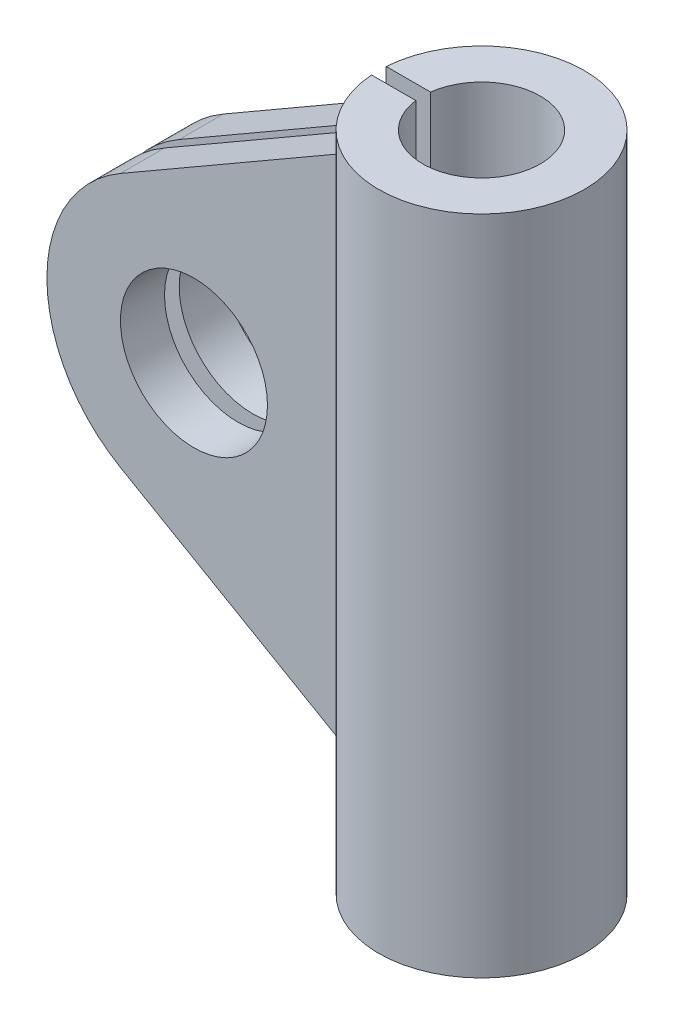
from build123d import *

# Parameters (mm, degrees)
SKETCH_1_R           = 10
EXTRUDE_1_DEPTH      = 7
EXTRUDE_2_DEPTH      = 20
EXTRUDE_2_DEPTH_BACK = 25
SKETCH_2_R           = 7
SKETCH_3_R           = 4
SKETCH_3_W           = 26.062177826
SKETCH_3_H           = 1
CUT_EXTRUDE_1_DEPTH  = 55
SKETCH_4_R           = 5
CUT_EXTRUDE_2_DEPTH  = 55


with BuildPart() as part:
    # Эскиз1 → Бобышка-Вытянуть1 (new body)
    with BuildSketch(Plane.XY):
        Circle(SKETCH_1_R)
        with BuildLine():
            Line((10, -17.320508076), (10, 0))
            ThreePointArc((10, 0), (5, -8.660254038), (-5, -8.660254038))
            Line((-5, -8.660254038), (10, -17.320508076))
        make_face()
        with BuildLine():
            Line((10, 17.320508076), (-5, 8.660254038))
            ThreePointArc((-5, 8.660254038), (5, 8.660254038), (10, 0))
            Line((10, 0), (10, 17.320508076))
        make_face()
    extrude(amount=EXTRUDE_1_DEPTH)

    # Эскиз2 → Бобышка-Вытянуть2 (add, two sides: drawn at the far end of the back side and taken through both)
    with BuildSketch(Plane(origin=(0, 0, 0), x_dir=(1, 0, 0), z_dir=(0, 1, 0)).offset(-EXTRUDE_2_DEPTH_BACK)):
        with Locations(Location((16.062177826, -3.5, 0), (0, 0, 270))):
            Circle(SKETCH_2_R)
    extrude(amount=EXTRUDE_2_DEPTH + EXTRUDE_2_DEPTH_BACK)

    # Эскиз3 → Вырез-Вытянуть1 (cut)
    with BuildSketch(Plane(origin=(0, 20, 0), x_dir=(1, 0, 0), z_dir=(0, 1, 0))):
        with Locations((16.062177826, -3.5)):
            Circle(SKETCH_3_R)
        with Locations((3.031088913, -3.5)):
            Rectangle(SKETCH_3_W, SKETCH_3_H)
    extrude(amount=-CUT_EXTRUDE_1_DEPTH, mode=Mode.SUBTRACT)

    # Эскиз4 → Вырез-Вытянуть2 (cut)
    with BuildSketch(Plane.XY.offset(7)):
        Circle(SKETCH_4_R)
    extrude(amount=-CUT_EXTRUDE_2_DEPTH, mode=Mode.SUBTRACT)


solid = part.part
